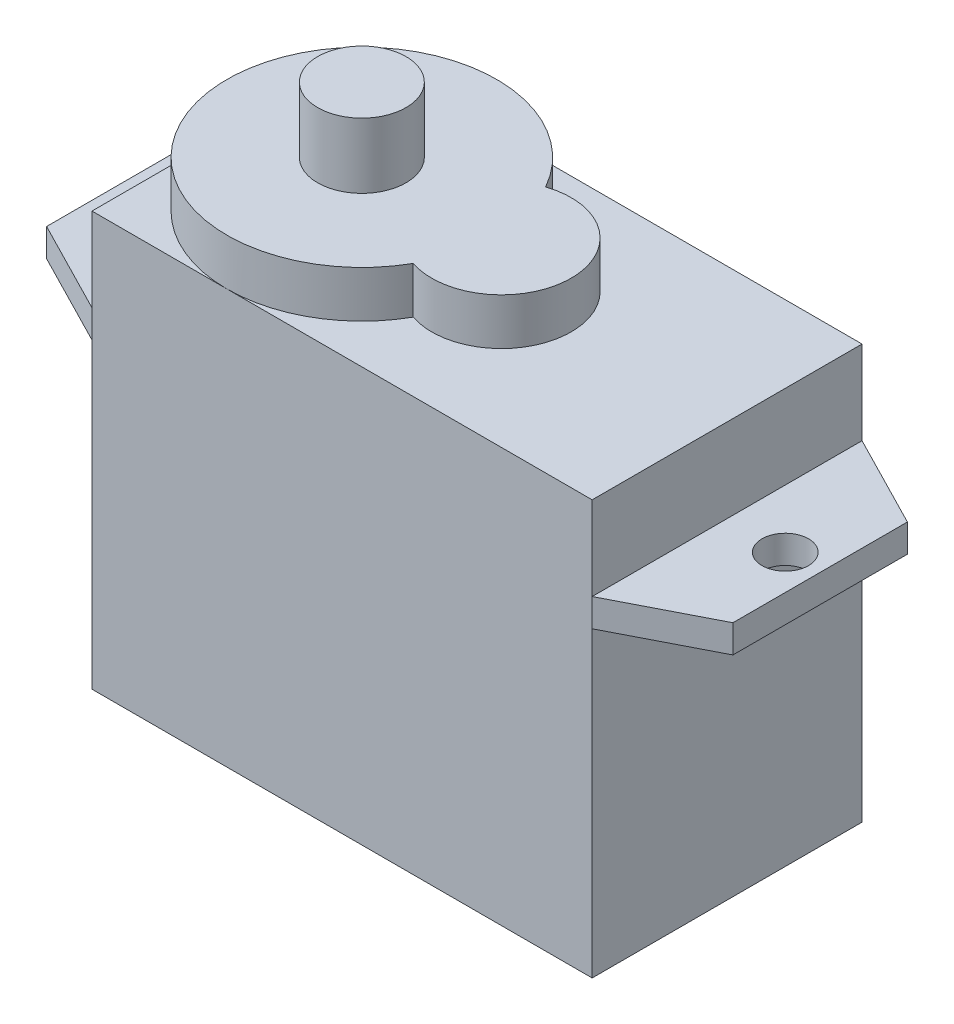
from build123d import *

# Parameters (mm, degrees)
SKETCH1_W           = 21.5
SKETCH1_H           = 11.6
BOSS_EXTRUDE1_DEPTH = 13
SKETCH2_R           = 1
BOSS_EXTRUDE2_DEPTH = 1.2
SKETCH3_W           = 21.5
SKETCH3_H           = 11.6
BOSS_EXTRUDE3_DEPTH = 3.6
BOSS_EXTRUDE4_DEPTH = 2
SKETCH5_R           = 1.9
BOSS_EXTRUDE5_DEPTH = 2.8


with BuildPart() as part:
    # Sketch1 → Boss-Extrude1 (new body)
    with BuildSketch(Plane(origin=(0, 0, 0), x_dir=(1, 0, 0), z_dir=(0, 1, 0))):
        Rectangle(SKETCH1_W, SKETCH1_H)
    extrude(amount=BOSS_EXTRUDE1_DEPTH)

    # Sketch2 → Boss-Extrude2 (add)
    with BuildSketch(Plane(origin=(0, 13, 0), x_dir=(1, 0, 0), z_dir=(0, 1, 0))):
        Polygon((-10.75, 5.8), (-14.75, 3.75), (-14.75, -3.75), (-10.75, -5.8), (10.75, -5.8), (14.75, -3.75), (14.75, 3.75), (10.75, 5.8), align=None)
        with Locations(Location((-13.25, 0, 0), (0, 0, 270))):
            Circle(SKETCH2_R, mode=Mode.SUBTRACT)
        with Locations(Location((13.25, 0, 0), (0, 0, 90))):
            Circle(SKETCH2_R, mode=Mode.SUBTRACT)
    extrude(amount=BOSS_EXTRUDE2_DEPTH)

    # Sketch3 → Boss-Extrude3 (add)
    with BuildSketch(Plane(origin=(0, 14.2, 0), x_dir=(1, 0, 0), z_dir=(0, 1, 0))):
        Rectangle(SKETCH3_W, SKETCH3_H)
    extrude(amount=BOSS_EXTRUDE3_DEPTH)

    # Sketch4 → Boss-Extrude4 (add)
    with BuildSketch(Plane(origin=(0, 17.8, 0), x_dir=(1, 0, 0), z_dir=(0, 1, 0))):
        with BuildLine():
            ThreePointArc((0.103333333, 2.846721311), (-10.75, 0), (0.103333333, -2.846721311))
            ThreePointArc((0.103333333, -2.846721311), (4.05, 0), (0.103333333, 2.846721311))
        make_face()
    extrude(amount=BOSS_EXTRUDE4_DEPTH)

    # Sketch5 → Boss-Extrude5 (add)
    with BuildSketch(Plane(origin=(0, 19.8, 0), x_dir=(1, 0, 0), z_dir=(0, 1, 0))):
        with Locations(Location((-4.95, 0, 0), (0, 0, 270))):
            Circle(SKETCH5_R)
    extrude(amount=BOSS_EXTRUDE5_DEPTH)


solid = part.part
